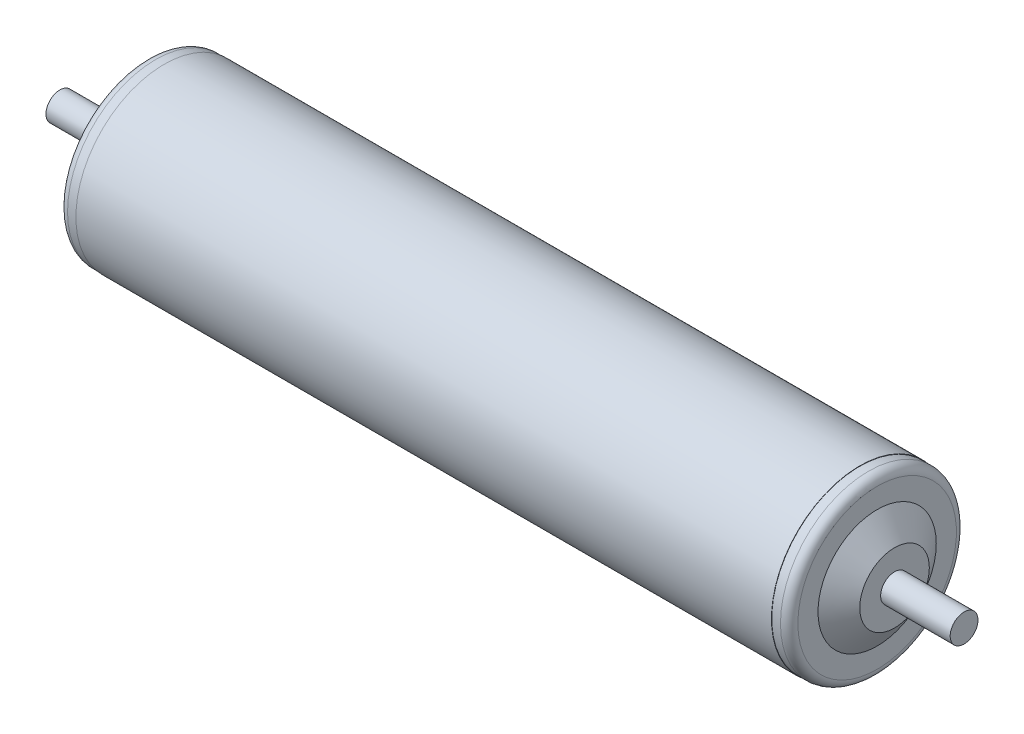
from build123d import *

# Parameters (mm, degrees)
FILLET1_R = 2.5


with BuildPart() as part:
    # Sketch1 → Revolve1 (revolve)
    with BuildSketch(Plane(origin=(0, 0, 0), x_dir=(1, 0, 0), z_dir=(0, 1, 0)), mode=Mode.PRIVATE) as revolve1_sk:
        Polygon((0, 0), (0, -25.4), (100, -25.4), (100, -25.3), (105, -25.3), (105, -17), (110, -10), (110, -4), (130, -4), (130, 0), align=None)
        Polygon((-100, -25.3), (-100, -25.4), (0, -25.4), (0, 0), (-130, 0), (-130, -4), (-110, -4), (-110, -10), (-105, -17), (-105, -25.3), align=None)
    revolve(revolve1_sk.sketch.rotate(Axis((130, 0, 0), (-1, 0, 0)), 180), axis=Axis((130, 0, 0), (-1, 0, 0)))

    # Fillet1
    fillet1_edges = [part.edges().sort_by_distance(p)[0] for p in [
        (105, 0, 25.3),
        (-105, 0, 25.3),
    ]]
    fillet(fillet1_edges, radius=FILLET1_R)


solid = part.part
